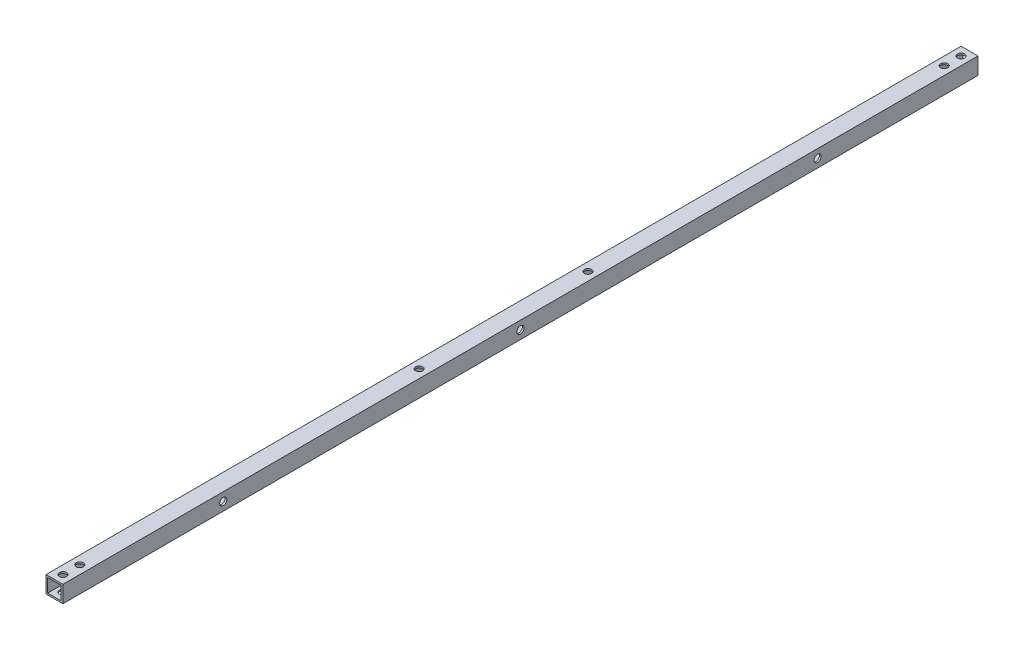
from build123d import *

# Parameters (mm, degrees)
SKETCH1_W           = 10
SKETCH1_H           = 10
SKETCH1_W_2         = 8
SKETCH1_H_2         = 8
BOSS_EXTRUDE1_DEPTH = 542
SKETCH2_R           = 2.125
CUT_EXTRUDE1_DEPTH  = 116
SKETCH3_R           = 2.1
SKETCH3_R_2         = 2.125
CUT_EXTRUDE2_DEPTH  = 10
SKETCH5_R           = 2.125
CUT_EXTRUDE3_DEPTH  = 10


with BuildPart() as part:
    # Sketch1 → Boss-Extrude1 (new body)
    with BuildSketch(Plane.XY):
        with Locations((5, 5)):
            Rectangle(SKETCH1_W, SKETCH1_H)
        with Locations((5, 5)):
            Rectangle(SKETCH1_W_2, SKETCH1_H_2, mode=Mode.SUBTRACT)
    extrude(amount=BOSS_EXTRUDE1_DEPTH)

    # Sketch2 → Cut-Extrude1 (cut)
    with BuildSketch(Plane(origin=(0, 10, 0), x_dir=(1, 0, 0), z_dir=(0, 1, 0))):
        with Locations(Location((5, -5, 0), (0, 0, 270))):
            Circle(SKETCH2_R)
        with Locations(Location((5, -15, 0), (0, 0, 270))):
            Circle(SKETCH2_R)
        with Locations(Location((5, -527, 0), (0, 0, 270))):
            Circle(SKETCH2_R)
        with Locations(Location((5, -537, 0), (0, 0, 270))):
            Circle(SKETCH2_R)
    extrude(amount=-CUT_EXTRUDE1_DEPTH, mode=Mode.SUBTRACT)

    # Sketch3 → Cut-Extrude2 (cut)
    with BuildSketch(Plane.XZ):
        with Locations(Location((5, 326, 0), (0, 0, 270))):
            Circle(SKETCH3_R)
        with Locations(Location((5, 226, 0), (0, 0, 270))):
            Circle(SKETCH3_R_2)
    extrude(amount=-CUT_EXTRUDE2_DEPTH, mode=Mode.SUBTRACT)

    # Sketch5 → Cut-Extrude3 (cut)
    with BuildSketch(Plane(origin=(10, 0, 0), x_dir=(0, 0, -1), z_dir=(1, 0, 0))):
        with Locations(Location((-447, 5, 0), (0, 0, 90))):
            Circle(SKETCH5_R)
        with Locations(Location((-95, 5, 0), (0, 0, 90))):
            Circle(SKETCH5_R)
        with Locations(Location((-271, 5, 0), (0, 0, 90))):
            Circle(SKETCH5_R)
    extrude(amount=-CUT_EXTRUDE3_DEPTH, mode=Mode.SUBTRACT)


solid = part.part
